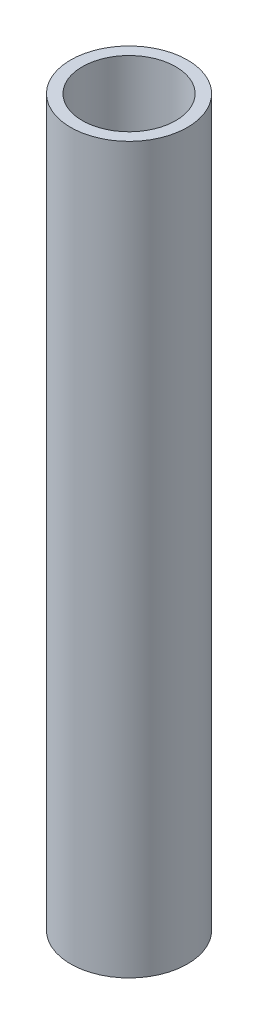
from build123d import *


with BuildPart() as part:
    # Sketch1 → Revolve1 (revolve)
    with BuildSketch(Plane.XY, mode=Mode.PRIVATE) as revolve1_sk:
        Polygon((14.29, 0), (14.29, 12.5), (12.7, 14.09), (12.7, 196.85), (15.875, 196.85), (15.875, 0), align=None)
    revolve(revolve1_sk.sketch.rotate(Axis((0, 0, 0), (0, 1, 0)), 90), axis=Axis((0, 0, 0), (0, 1, 0)))


solid = part.part
